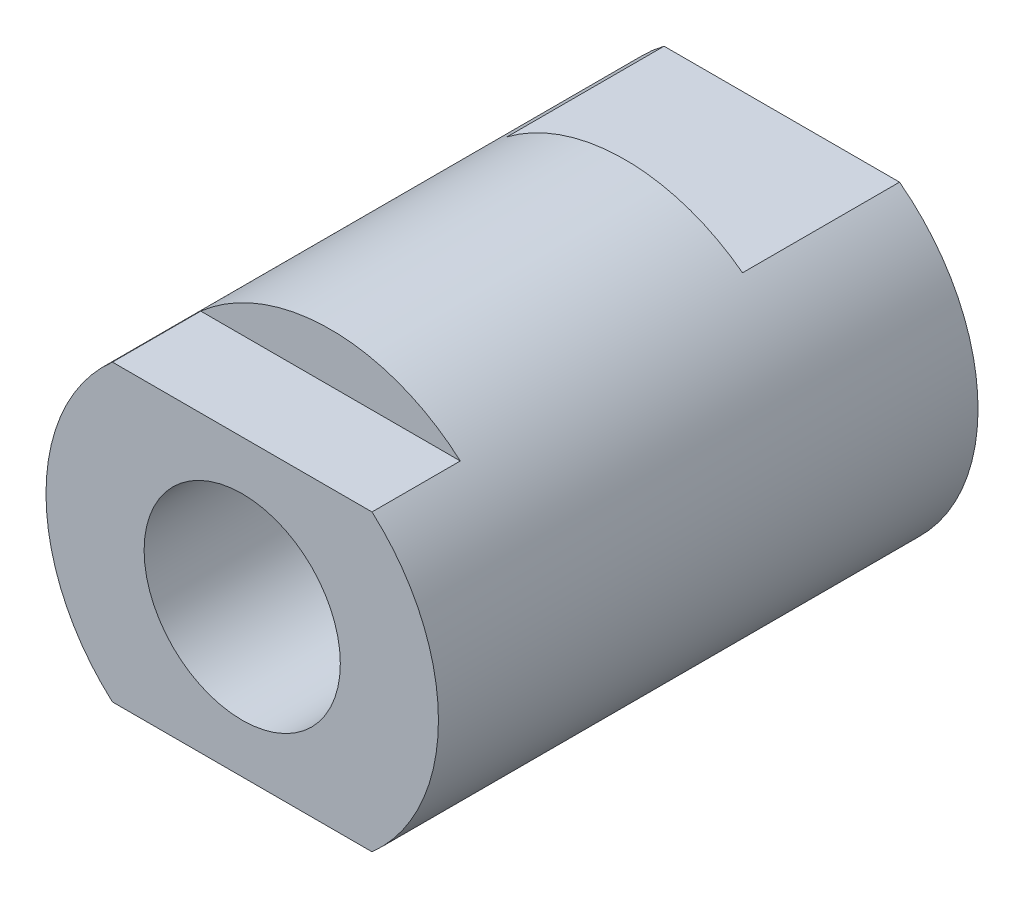
from build123d import *
from build123d.topology import SkipClean

# Parameters (mm, degrees)
SKETCH3_R           = 1
BOSS_EXTRUDE1_DEPTH = 11
SKETCH4_R           = 2
BOSS_EXTRUDE2_DEPTH = 4.6
SKETCH8_R           = 1
CUT_EXTRUDE2_DEPTH  = 7.184658438
CUT_EXTRUDE5_START  = -0.9
CUT_EXTRUDE5_DEPTH  = 0.9
CUT_EXTRUDE6_DEPTH  = 1.6


with BuildPart() as part:
    # Sketch3 → Boss-Extrude1 (new body)
    with BuildSketch(Plane.XY):
        with BuildLine():
            Line((1.322875656, 1.5), (-1.322875656, 1.5))
            ThreePointArc((-1.322875656, 1.5), (0, -2), (1.322875656, 1.5))
        make_face()
        Circle(SKETCH3_R, mode=Mode.SUBTRACT)
    extrude(amount=BOSS_EXTRUDE1_DEPTH)

    # Sketch4 → Boss-Extrude2 (add, symmetric)
    with BuildSketch(Plane.XY.offset(5.5)):
        with Locations(Location((0, 0, 0), (0, 0, 131.409622109))):
            Circle(SKETCH4_R)
    extrude(amount=BOSS_EXTRUDE2_DEPTH, both=True)

    # Split1
    split(bisect_by=Plane.XY.offset(5.5), keep=Keep.TOP)

    # Sketch8 → Cut-Extrude2 (cut, through all)
    with SkipClean():  # the faces are left unmerged after this step: merging them gives an invalid solid
        with BuildSketch(Plane.XY.offset(5.5)):
            Circle(SKETCH8_R)
        extrude(amount=CUT_EXTRUDE2_DEPTH, mode=Mode.SUBTRACT)

    # Sketch9 → Cut-Extrude5 (cut)
    with SkipClean():  # the faces are left unmerged after this step: merging them gives an invalid solid
        with BuildSketch(Plane.XY.offset(11).offset(CUT_EXTRUDE5_START)):
            with BuildLine():
                Line((1.322875656, -1.5), (-1.322875656, -1.5))
                ThreePointArc((-1.322875656, -1.5), (0, -2), (1.322875656, -1.5))
            make_face()
        extrude(amount=CUT_EXTRUDE5_DEPTH, mode=Mode.SUBTRACT)

    # Sketch12 → Cut-Extrude6 (cut)
    with SkipClean():  # the faces are left unmerged after this step: merging them gives an invalid solid
        with BuildSketch(Plane(origin=(0, 0, 5.5), x_dir=(-1, 0, 0), z_dir=(0, 0, -1))):
            with BuildLine():
                Line((-1.2, 1.6), (1.2, 1.6))
                ThreePointArc((1.2, 1.6), (0, 2), (-1.2, 1.6))
            make_face()
        extrude(amount=-CUT_EXTRUDE6_DEPTH, mode=Mode.SUBTRACT)


solid = part.part
